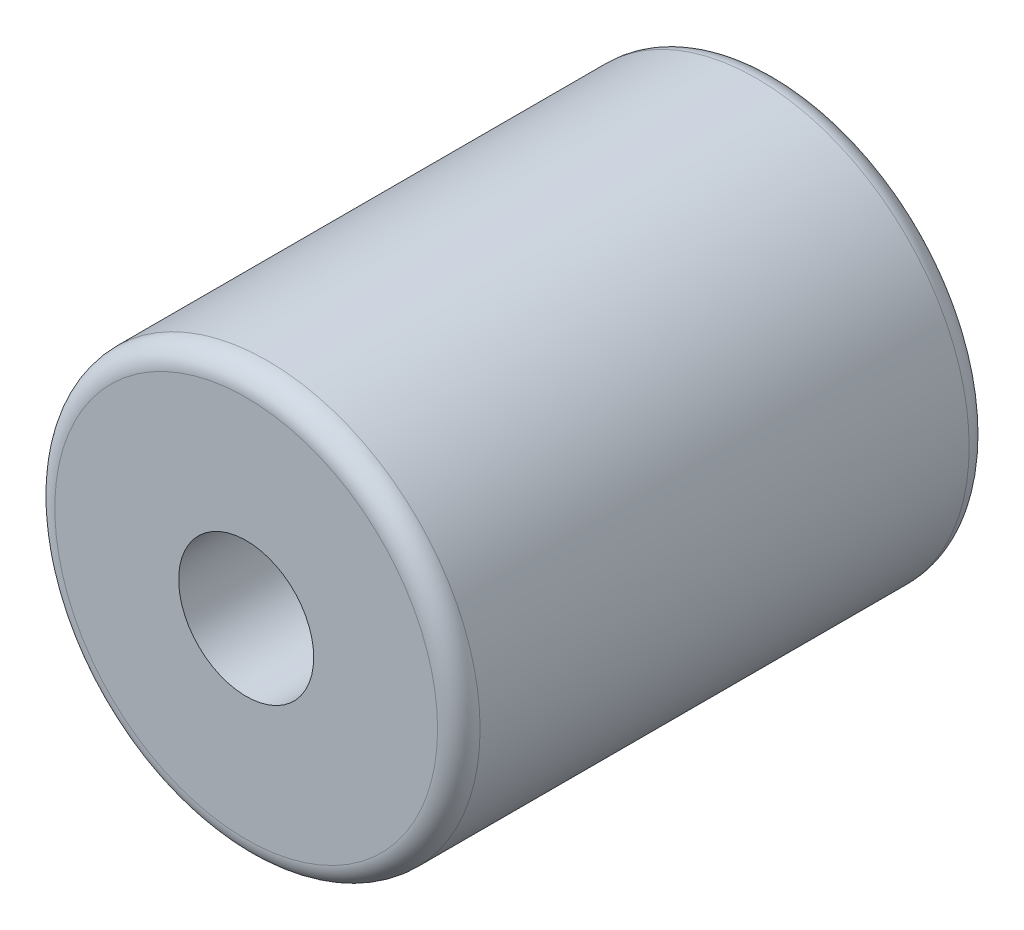
from build123d import *

# Parameters (mm, degrees)
SKETCH_1_R      = 10
SKETCH_1_R_2    = 3.175
EXTRUDE_1_DEPTH = 25
FILLET_2_R      = 1


with BuildPart() as part:
    # 草图1 → 凸台-拉伸1 (new body)
    with BuildSketch(Plane.XY):
        Circle(SKETCH_1_R)
        Circle(SKETCH_1_R_2, mode=Mode.SUBTRACT)
    extrude(amount=EXTRUDE_1_DEPTH)

    # 圆角2
    fillet_2_edges = [part.edges().sort_by_distance(p)[0] for p in [
        (-10, 0, 0),
        (-10, 0, 25),
    ]]
    fillet(fillet_2_edges, radius=FILLET_2_R)


solid = part.part
